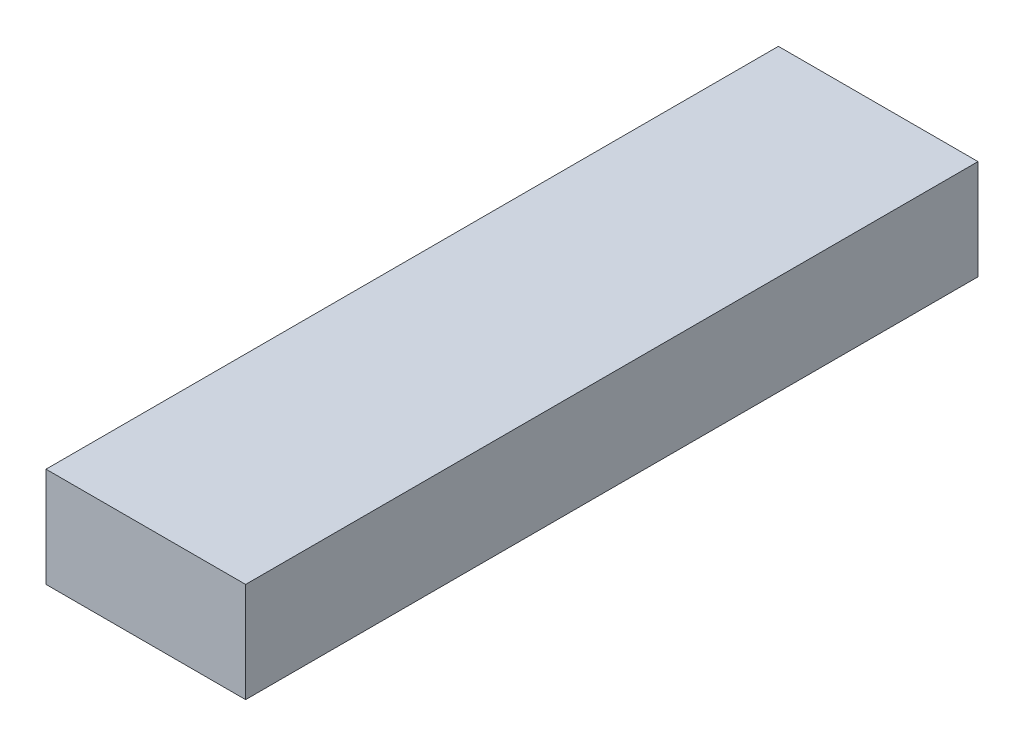
from build123d import *

# Parameters (mm, degrees)
SKETCH1_W           = 8
SKETCH1_H           = 29.35205212
BOSS_EXTRUDE1_DEPTH = 4


with BuildPart() as part:
    # Sketch1 → Boss-Extrude1 (new body)
    with BuildSketch(Plane(origin=(0, 0, 0), x_dir=(1, 0, 0), z_dir=(0, 1, 0))):
        Rectangle(SKETCH1_W, SKETCH1_H)
    extrude(amount=BOSS_EXTRUDE1_DEPTH)


solid = part.part
